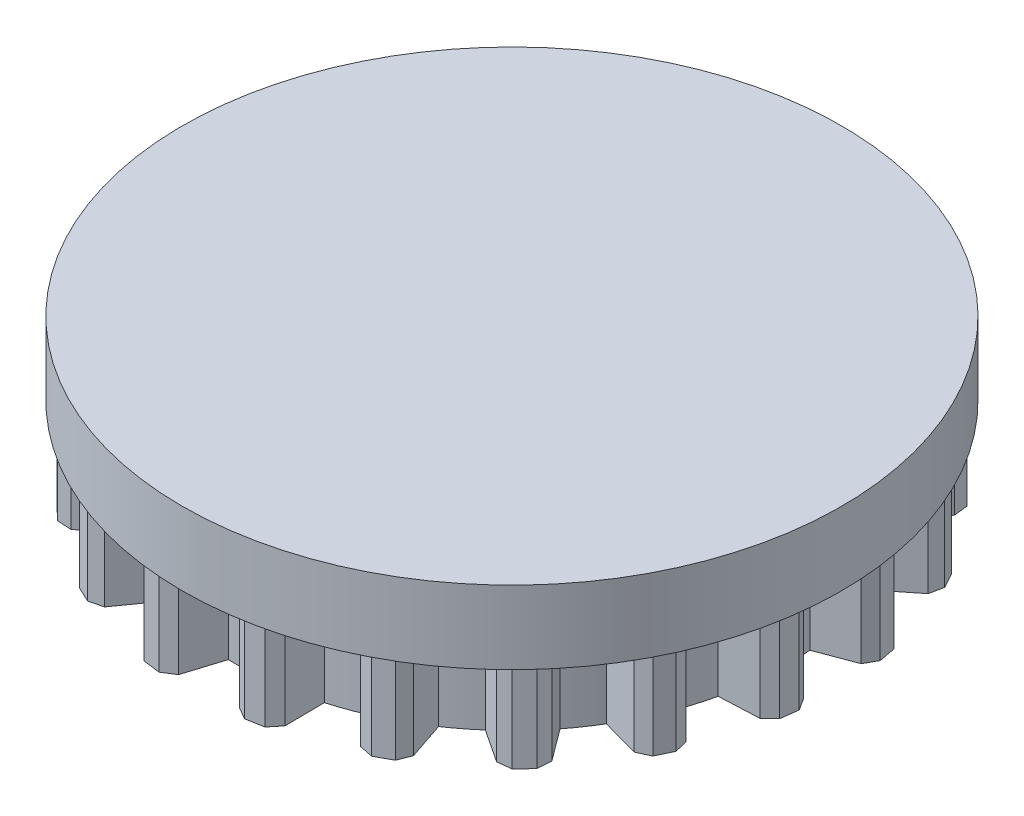
from build123d import *

# Parameters (mm, degrees)
BOSS_EXTRUDE2_DEPTH = 127
SKETCH3_R           = 457.2
BOSS_EXTRUDE3_DEPTH = 101.6
SKETCH4_R           = 63.5
CUT_EXTRUDE1_DEPTH  = 76.2


with BuildPart() as part:
    # Sketch1 → Boss-Extrude2 (new body)
    with BuildSketch(Plane(origin=(0, 0, 0), x_dir=(1, 0, 0), z_dir=(0, 1, 0))):
        with BuildLine():
            Line((-358.285919954, 129.584719634), (-403.302421761, 161.579989966))
            Line((-403.302421761, 161.579989966), (-408.206038182, 180.409487441))
            Line((-408.206038182, 180.409487441), (-397.783371142, 202.356473607))
            Line((-397.783371142, 202.356473607), (-380.091440099, 210.455301))
            Line((-380.091440099, 210.455301), (-326.846738593, 195.786131968))
            ThreePointArc((-326.846738593, 195.786131968), (-314.356463225, 215.269630995), (-300.706278291, 233.958830131))
            Line((-300.706278291, 233.958830131), (-333.632433402, 278.299004557))
            Line((-333.632433402, 278.299004557), (-332.477415039, 297.722221637))
            Line((-332.477415039, 297.722221637), (-315.782877932, 315.374264601))
            Line((-315.782877932, 315.374264601), (-296.454176329, 317.609599812))
            Line((-296.454176329, 317.609599812), (-250.348478528, 287.20487339))
            ThreePointArc((-250.348478528, 287.20487339), (-232.44878844, 301.875074746), (-213.691410965, 315.431420248))
            Line((-213.691410965, 315.431420248), (-231.304177909, 367.776173558))
            Line((-231.304177909, 367.776173558), (-224.203586005, 385.891830426))
            Line((-224.203586005, 385.891830426), (-202.871356441, 397.521025234))
            Line((-202.871356441, 397.521025234), (-183.797912262, 393.674058078))
            Line((-183.797912262, 393.674058078), (-149.344365104, 350.51000073))
            ThreePointArc((-149.344365104, 350.51000073), (-127.787406676, 358.930882894), (-105.758939458, 366.027385211))
            Line((-105.758939458, 366.027385211), (-106.334257891, 421.252848245))
            Line((-106.334257891, 421.252848245), (-93.983147854, 436.287658187))
            Line((-93.983147854, 436.287658187), (-70.101373095, 440.755658225))
            Line((-70.101373095, 440.755658225), (-53.150227948, 431.202956651))
            Line((-53.150227948, 431.202956651), (-33.72138468, 379.504767052))
            ThreePointArc((-33.72138468, 379.504767052), (-10.617303199, 380.852035406), (12.525953909, 380.794039447))
            Line((12.525953909, 380.794039447), (29.044400164, 433.494359103))
            Line((29.044400164, 433.494359103), (45.437015627, 443.97661017))
            Line((45.437015627, 443.97661017), (69.530621076, 440.846056464))
            Line((69.530621076, 440.846056464), (82.700170997, 426.522705459))
            Line((82.700170997, 426.522705459), (85.202479827, 371.35096261))
            ThreePointArc((85.202479827, 371.35096261), (107.59209589, 365.49273714), (129.584719634, 358.285919954))
            Line((129.584719634, 358.285919954), (161.579989966, 403.302421761))
            Line((161.579989966, 403.302421761), (180.409487441, 408.206038182))
            Line((180.409487441, 408.206038182), (202.356473607, 397.783371142))
            Line((202.356473607, 397.783371142), (210.455301, 380.091440099))
            Line((210.455301, 380.091440099), (195.786131968, 326.846738593))
            ThreePointArc((195.786131968, 326.846738593), (215.269630995, 314.356463225), (233.958830131, 300.706278291))
            Line((233.958830131, 300.706278291), (278.299004557, 333.632433402))
            Line((278.299004557, 333.632433402), (297.722221637, 332.477415039))
            Line((297.722221637, 332.477415039), (315.374264601, 315.782877932))
            Line((315.374264601, 315.782877932), (317.609599812, 296.454176329))
            Line((317.609599812, 296.454176329), (287.20487339, 250.348478528))
            ThreePointArc((287.20487339, 250.348478528), (301.875074746, 232.44878844), (315.431420248, 213.691410965))
            Line((315.431420248, 213.691410965), (367.776173558, 231.304177909))
            Line((367.776173558, 231.304177909), (385.891830426, 224.203586005))
            Line((385.891830426, 224.203586005), (397.521025234, 202.871356441))
            Line((397.521025234, 202.871356441), (393.674058078, 183.797912262))
            Line((393.674058078, 183.797912262), (350.51000073, 149.344365104))
            ThreePointArc((350.51000073, 149.344365104), (358.930882894, 127.787406676), (366.027385211, 105.758939458))
            Line((366.027385211, 105.758939458), (421.252848245, 106.334257891))
            Line((421.252848245, 106.334257891), (436.287658187, 93.983147854))
            Line((436.287658187, 93.983147854), (440.755658225, 70.101373095))
            Line((440.755658225, 70.101373095), (431.202956651, 53.150227948))
            Line((431.202956651, 53.150227948), (379.504767052, 33.72138468))
            ThreePointArc((379.504767052, 33.72138468), (380.852035406, 10.617303199), (380.794039447, -12.525953909))
            Line((380.794039447, -12.525953909), (433.494359103, -29.044400164))
            Line((433.494359103, -29.044400164), (443.97661017, -45.437015627))
            Line((443.97661017, -45.437015627), (440.846056464, -69.530621076))
            Line((440.846056464, -69.530621076), (426.522705459, -82.700170997))
            Line((426.522705459, -82.700170997), (371.35096261, -85.202479827))
            ThreePointArc((371.35096261, -85.202479827), (365.49273714, -107.59209589), (358.285919954, -129.584719634))
            Line((358.285919954, -129.584719634), (403.302421761, -161.579989966))
            Line((403.302421761, -161.579989966), (408.206038182, -180.409487441))
            Line((408.206038182, -180.409487441), (397.783371142, -202.356473607))
            Line((397.783371142, -202.356473607), (380.091440099, -210.455301))
            Line((380.091440099, -210.455301), (326.846738593, -195.786131968))
            ThreePointArc((326.846738593, -195.786131968), (314.356463225, -215.269630995), (300.706278291, -233.958830131))
            Line((300.706278291, -233.958830131), (333.632433402, -278.299004557))
            Line((333.632433402, -278.299004557), (332.477415039, -297.722221637))
            Line((332.477415039, -297.722221637), (315.782877932, -315.374264601))
            Line((315.782877932, -315.374264601), (296.454176329, -317.609599812))
            Line((296.454176329, -317.609599812), (250.348478528, -287.20487339))
            ThreePointArc((250.348478528, -287.20487339), (232.44878844, -301.875074746), (213.691410965, -315.431420248))
            Line((213.691410965, -315.431420248), (231.304177909, -367.776173558))
            Line((231.304177909, -367.776173558), (224.203586005, -385.891830426))
            Line((224.203586005, -385.891830426), (202.871356441, -397.521025234))
            Line((202.871356441, -397.521025234), (183.797912262, -393.674058078))
            Line((183.797912262, -393.674058078), (149.344365104, -350.51000073))
            ThreePointArc((149.344365104, -350.51000073), (127.787406676, -358.930882894), (105.758939458, -366.027385211))
            Line((105.758939458, -366.027385211), (106.334257891, -421.252848245))
            Line((106.334257891, -421.252848245), (93.983147854, -436.287658187))
            Line((93.983147854, -436.287658187), (70.101373095, -440.755658225))
            Line((70.101373095, -440.755658225), (53.150227948, -431.202956651))
            Line((53.150227948, -431.202956651), (33.72138468, -379.504767052))
            ThreePointArc((33.72138468, -379.504767052), (10.617303199, -380.852035406), (-12.525953909, -380.794039447))
            Line((-12.525953909, -380.794039447), (-29.044400164, -433.494359103))
            Line((-29.044400164, -433.494359103), (-45.437015627, -443.97661017))
            Line((-45.437015627, -443.97661017), (-69.530621076, -440.846056464))
            Line((-69.530621076, -440.846056464), (-82.700170997, -426.522705459))
            Line((-82.700170997, -426.522705459), (-85.202479827, -371.35096261))
            ThreePointArc((-85.202479827, -371.35096261), (-107.59209589, -365.49273714), (-129.584719634, -358.285919954))
            Line((-129.584719634, -358.285919954), (-161.579989966, -403.302421761))
            Line((-161.579989966, -403.302421761), (-180.409487441, -408.206038182))
            Line((-180.409487441, -408.206038182), (-202.356473607, -397.783371142))
            Line((-202.356473607, -397.783371142), (-210.455301, -380.091440099))
            Line((-210.455301, -380.091440099), (-195.786131968, -326.846738593))
            ThreePointArc((-195.786131968, -326.846738593), (-215.269630995, -314.356463225), (-233.958830131, -300.706278291))
            Line((-233.958830131, -300.706278291), (-278.299004557, -333.632433402))
            Line((-278.299004557, -333.632433402), (-297.722221637, -332.477415039))
            Line((-297.722221637, -332.477415039), (-315.374264601, -315.782877932))
            Line((-315.374264601, -315.782877932), (-317.609599812, -296.454176329))
            Line((-317.609599812, -296.454176329), (-287.20487339, -250.348478528))
            ThreePointArc((-287.20487339, -250.348478528), (-301.875074746, -232.44878844), (-315.431420248, -213.691410965))
            Line((-315.431420248, -213.691410965), (-367.776173558, -231.304177909))
            Line((-367.776173558, -231.304177909), (-385.891830426, -224.203586005))
            Line((-385.891830426, -224.203586005), (-397.521025234, -202.871356441))
            Line((-397.521025234, -202.871356441), (-393.674058078, -183.797912262))
            Line((-393.674058078, -183.797912262), (-350.51000073, -149.344365104))
            ThreePointArc((-350.51000073, -149.344365104), (-358.930882894, -127.787406676), (-366.027385211, -105.758939458))
            Line((-366.027385211, -105.758939458), (-421.252848245, -106.334257891))
            Line((-421.252848245, -106.334257891), (-436.287658187, -93.983147854))
            Line((-436.287658187, -93.983147854), (-440.755658225, -70.101373095))
            Line((-440.755658225, -70.101373095), (-431.202956651, -53.150227948))
            Line((-431.202956651, -53.150227948), (-379.504767052, -33.72138468))
            ThreePointArc((-379.504767052, -33.72138468), (-380.852035406, -10.617303199), (-380.794039447, 12.525953909))
            Line((-380.794039447, 12.525953909), (-433.494359103, 29.044400164))
            Line((-433.494359103, 29.044400164), (-443.97661017, 45.437015627))
            Line((-443.97661017, 45.437015627), (-440.846056464, 69.530621076))
            Line((-440.846056464, 69.530621076), (-426.522705459, 82.700170997))
            Line((-426.522705459, 82.700170997), (-371.35096261, 85.202479827))
            ThreePointArc((-371.35096261, 85.202479827), (-365.49273714, 107.59209589), (-358.285919954, 129.584719634))
        make_face()
    extrude(amount=BOSS_EXTRUDE2_DEPTH)

    # Sketch3 → Boss-Extrude3 (add)
    with BuildSketch(Plane(origin=(0, 127, 0), x_dir=(1, 0, 0), z_dir=(0, 1, 0))):
        with Locations(Location((0, 0, 0), (0, 0, 270))):
            Circle(SKETCH3_R)
    extrude(amount=BOSS_EXTRUDE3_DEPTH)

    # Sketch4 → Cut-Extrude1 (cut)
    with BuildSketch(Plane(origin=(0, 0, 0), x_dir=(-1, 0, 0), z_dir=(0, -1, 0))):
        with Locations(Location((0, 0, 0), (0, 0, 90))):
            Circle(SKETCH4_R)
    extrude(amount=-CUT_EXTRUDE1_DEPTH, mode=Mode.SUBTRACT)


solid = part.part
